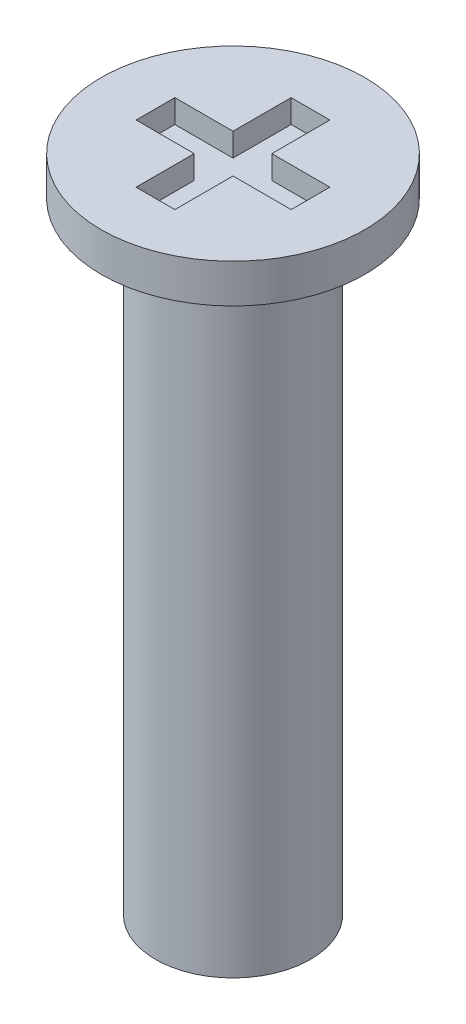
from build123d import *

# Parameters (mm, degrees)
SKETCH_2_W               = 0.5
SKETCH_2_H               = 1
CUT_EXTRUDE_1_DEPTH      = 0.3
PATTERN_CIRCULAR_1_COUNT = 4


with BuildPart() as part:
    # ｽｹｯﾁ1 → 回転1 (revolve)
    with BuildSketch(Plane.XY, mode=Mode.PRIVATE) as revolve_1_sk:
        Polygon((0, 0), (1.7, 0), (1.7, -0.5), (1, -0.5), (1, -8.5), (0, -8.5), align=None)
    revolve(revolve_1_sk.sketch.rotate(Axis((0, -8.5, 0), (0, 1, 0)), 90), axis=Axis((0, -8.5, 0), (0, 1, 0)))

    # ｽｹｯﾁ2 → ｶｯﾄ - 押し出し1 (cut)
    with BuildSketch(Plane(origin=(0, 0, 0), x_dir=(1, 0, 0), z_dir=(0, 1, 0))):
        with Locations((0, 0.5)):
            Rectangle(SKETCH_2_W, SKETCH_2_H)
    cut_extrude_1 = extrude(amount=-CUT_EXTRUDE_1_DEPTH, mode=Mode.SUBTRACT)

    # 円形ﾊﾟﾀｰﾝ1: ｶｯﾄ - 押し出し1 ×4 about axis
    pattern_circular_1_axis = Axis((0, 0, 0), (0, 1, 0))
    for i in range(1, PATTERN_CIRCULAR_1_COUNT):
        add(cut_extrude_1.rotate(pattern_circular_1_axis, i * 360 / PATTERN_CIRCULAR_1_COUNT), mode=Mode.SUBTRACT)


solid = part.part
